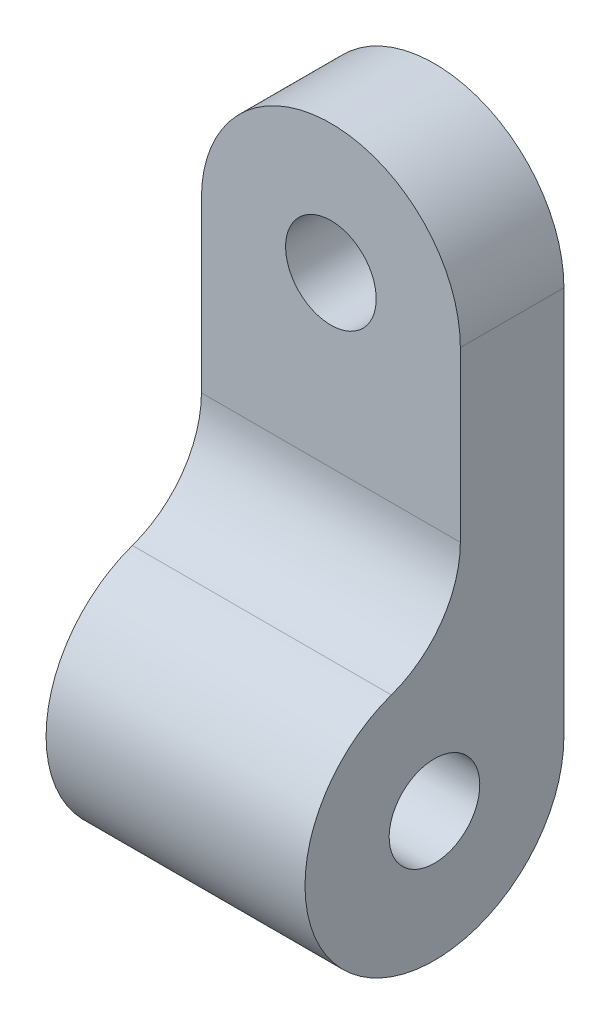
from build123d import *

# Parameters (mm, degrees)
ESBO_O1_R                = 1.75
RESSALTO_EXTRUS_O1_DEPTH = 10
ESBO_O2_W                = 6
ESBO_O2_H                = 5
ESBO_O2_R                = 1.75
CORTE_EXTRUS_O1_DEPTH    = 10


with BuildPart() as part:
    # Esboço1 → Ressalto-extrusão1 (new body)
    with BuildSketch(Plane.XY):
        with BuildLine():
            Line((-5, 0), (-5, -20))
            Line((-5, -20), (5, -20))
            Line((5, -20), (5, 0))
            ThreePointArc((5, 0), (0, 5), (-5, 0))
        make_face()
        Circle(ESBO_O1_R, mode=Mode.SUBTRACT)
    extrude(amount=RESSALTO_EXTRUS_O1_DEPTH)

    # Esboço2 → Corte-extrusão1 (cut)
    with BuildSketch(Plane.ZY.offset(5)):
        with BuildLine():
            Line((10, 0), (4, 0))
            Line((4, 0), (4, -6.514718626))
            ThreePointArc((4, -6.514718626), (4.734013676, -8.824119703), (6.666666667, -10.285954792))
            ThreePointArc((6.666666667, -10.285954792), (9.082482905, -12.113248654), (10, -15))
            Line((10, -15), (10, 0))
        make_face()
        with Locations((7, 2.5)):
            Rectangle(ESBO_O2_W, ESBO_O2_H)
        with BuildLine():
            Line((10, -20), (10, -15))
            ThreePointArc((10, -15), (8.535533906, -18.535533906), (5, -20))
            Line((5, -20), (10, -20))
        make_face()
        with BuildLine():
            ThreePointArc((5, -20), (1.464466094, -18.535533906), (0, -15))
            Line((0, -15), (0, -20))
            Line((0, -20), (5, -20))
        make_face()
        with Locations(Location((5, -15, 0), (0, 0, 270))):
            Circle(ESBO_O2_R)
    extrude(amount=-CORTE_EXTRUS_O1_DEPTH, mode=Mode.SUBTRACT)


solid = part.part
